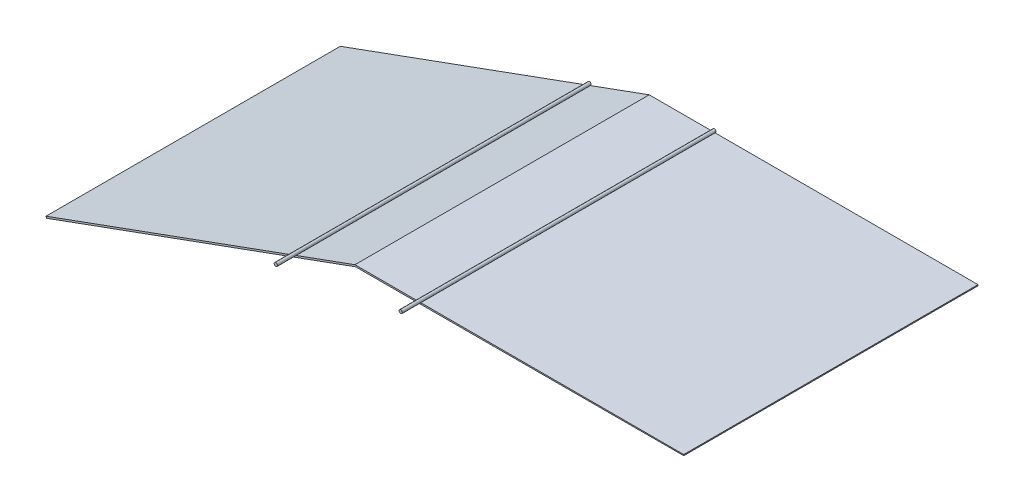
from build123d import *

# Parameters (mm, degrees)
RESSALTO_EXTRUS_O3_DEPTH   = 895
ESBO_O12_R                 = 5
RESSALTO_EXTRUS_O4_DEPTH   = 954
RESSALTO_EXTRUS_O4_2_DEPTH = 954


with BuildPart() as part:
    # Esboço10 → Ressalto-extrusão3 (new body)
    with BuildSketch(Plane.XY):
        Polygon((943.293464845, 0), (-56.706535155, 0), (-996.399155941, -342.020143326), (-994.689055225, -346.71860643), (-54.996434439, -4.698463104), (943.293464845, -3.156637289), align=None)
    extrude(amount=RESSALTO_EXTRUS_O3_DEPTH)


with BuildPart() as body_2:
    # Esboço12 → Ressalto-extrusão4 (new body)
    with BuildSketch(Plane(origin=(0, 0, 0), x_dir=(-1, 0, 0), z_dir=(0, 0, -1))):
        with Locations((-141.531462956, 5)):
            Circle(ESBO_O12_R)
    extrude(amount=-RESSALTO_EXTRUS_O4_DEPTH)


with BuildPart() as body_3:
    # Esboço12 → Ressalto-extrus_o4 2 (new body)
    with BuildSketch(Plane(origin=(0, 0, 0), x_dir=(-1, 0, 0), z_dir=(0, 0, -1))):
        with Locations((238.371547446, -60.799768219)):
            Circle(ESBO_O12_R)
    extrude(amount=-RESSALTO_EXTRUS_O4_2_DEPTH)


solid = Compound([part.part, body_2.part, body_3.part])
